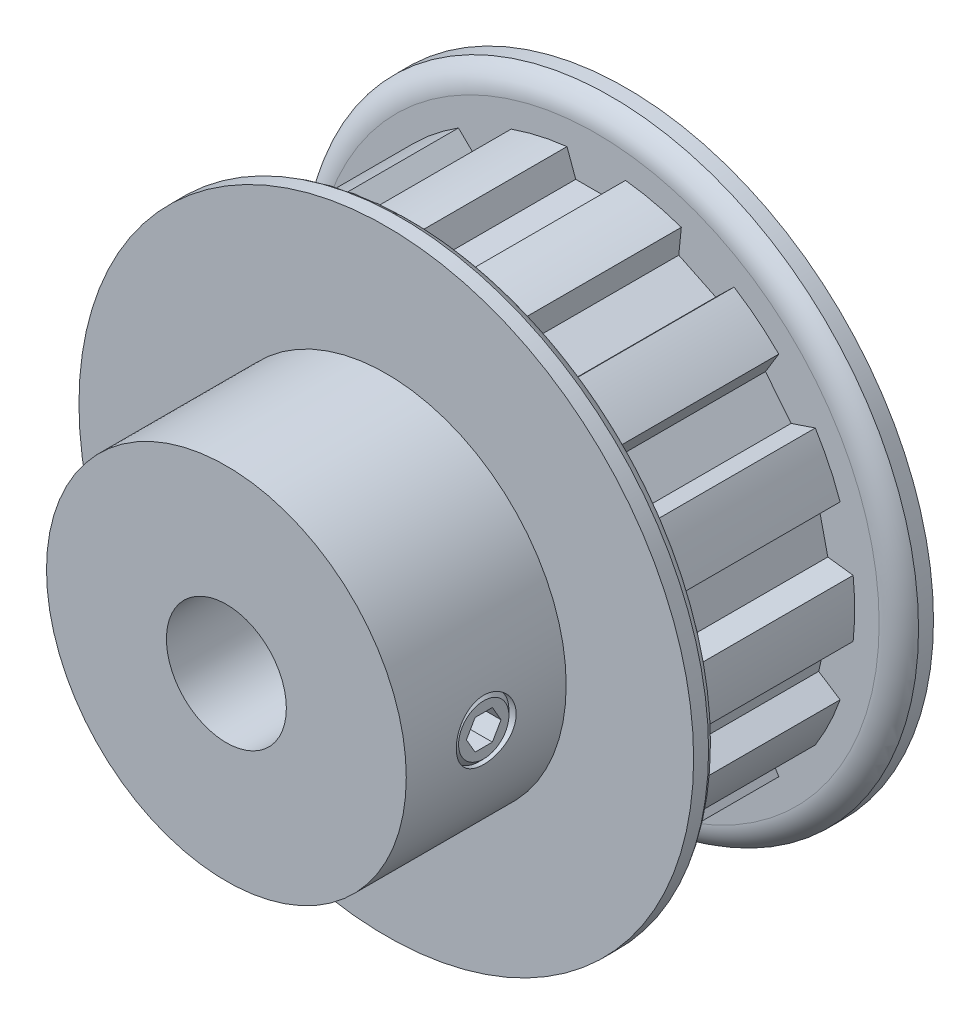
from build123d import *

# Parameters (mm, degrees)
CUT_EXTRUDE1_START = 0.8001
CUT_EXTRUDE1_DEPTH = 14.3002
CIRPATTERN1_COUNT  = 14
SKETCH4_R          = 2.38125
CUT_EXTRUDE2_DEPTH = 38.995437117
CUT_EXTRUDE3_DEPTH = 1.7859375


with BuildPart() as part:
    # Sketch2 → Revolve1 (revolve)
    with BuildSketch(Plane(origin=(0, 0, 0), x_dir=(0, 0, -1), z_dir=(1, 0, 0)), mode=Mode.PRIVATE) as revolve1_sk:
        with BuildLine():
            Line((-15.875, 4.7625), (15.875, 4.7625))
            Line((15.875, 4.7625), (15.875, 24.4094))
            Line((15.875, 24.4094), (14.68755, 24.4094))
            ThreePointArc((14.68755, 24.4094), (13.820515654, 23.606333406), (13.5001, 22.468792937))
            Line((13.5001, 22.468792937), (13.5001, 20.528185873))
            Line((13.5001, 20.528185873), (-0.8001, 20.528185873))
            Line((-0.8001, 20.528185873), (-0.8001, 22.468792937))
            ThreePointArc((-0.8001, 22.468792937), (-1.120515654, 23.606333406), (-1.98755, 24.4094))
            Line((-1.98755, 24.4094), (-3.175, 24.4094))
            Line((-3.175, 24.4094), (-3.175, 14.2875))
            Line((-3.175, 14.2875), (-15.875, 14.2875))
            Line((-15.875, 14.2875), (-15.875, 4.7625))
        make_face()
    revolve(revolve1_sk.sketch.rotate(Axis((0, 0, 15.875), (0, 0, -1)), 90), axis=Axis((0, 0, 15.875), (0, 0, -1)))

    # Sketch3 → Cut-Extrude1 (cut)
    with BuildSketch(Plane.XY.offset(CUT_EXTRUDE1_START)):
        with BuildLine():
            Line((-1.630736704, 18.4912), (1.630736704, 18.4912))
            Line((1.630736704, 18.4912), (2.3241, 20.3962))
            ThreePointArc((2.3241, 20.3962), (0, 20.528185873), (-2.3241, 20.3962))
            Line((-2.3241, 20.3962), (-1.630736704, 18.4912))
        make_face()
    cut_extrude1 = extrude(amount=-CUT_EXTRUDE1_DEPTH, mode=Mode.SUBTRACT)

    # CirPattern1: Cut-Extrude1 ×14 about axis
    cirpattern1_axis = Axis((0, 0, 0), (0, 0, 1))
    for i in range(1, CIRPATTERN1_COUNT):
        add(cut_extrude1.rotate(cirpattern1_axis, i * 360 / CIRPATTERN1_COUNT), mode=Mode.SUBTRACT)

    # Sketch4 → Cut-Extrude2 (cut, through all)
    with BuildSketch(Plane(origin=(0, 0, 0), x_dir=(0, -1, 0), z_dir=(1, 0, 0))):
        with Locations(Location((0, -9.525, 0), (0, 0, 270))):
            Circle(SKETCH4_R)
    extrude(amount=CUT_EXTRUDE2_DEPTH, mode=Mode.SUBTRACT)

    # Sketch5 → Revolve2 (revolve)
    with BuildSketch(Plane.XY.offset(9.525)):
        Polygon((4.7625, -2.00025), (4.7625, 0), (14.087664984, 0), (14.087664984, -2.00025), (13.706664984, -2.38125), (5.1435, -2.38125), align=None)
    revolve(axis=Axis((4.7625, 0, 9.525), (1, 0, 0)))

    # Sketch6 → Cut-Extrude3 (cut)
    with BuildSketch(Plane(origin=(14.087664984, 5.384140679, 0), x_dir=(0, -1, 0), z_dir=(-1, 0, 0))):
        Polygon((5.384140679, 10.899815329), (4.193515679, 10.212407664), (4.193515679, 8.837592336), (5.384140679, 8.150184671), (6.574765679, 8.837592336), (6.574765679, 10.212407664), align=None)
    extrude(amount=CUT_EXTRUDE3_DEPTH, mode=Mode.SUBTRACT)


solid = part.part
